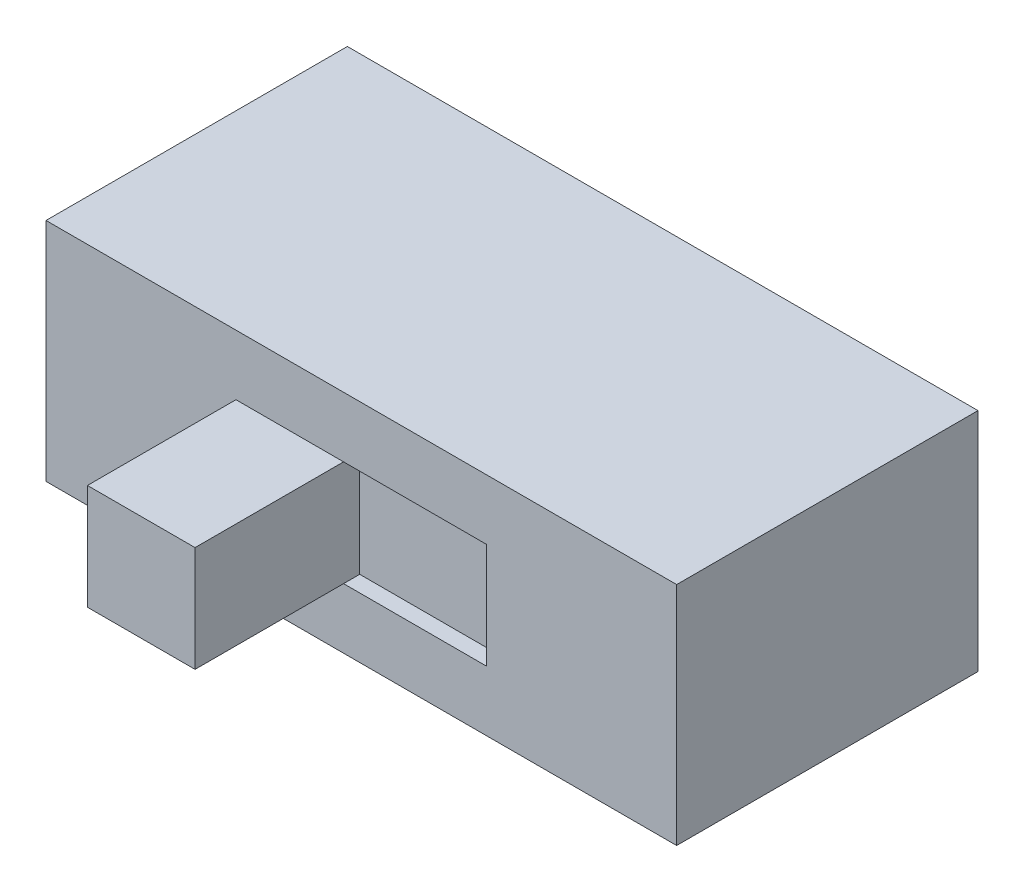
from build123d import *

# Parameters (mm, degrees)
SKETCH1_W           = 11.72
SKETCH1_H           = 5.6
BOSS_EXTRUDE1_DEPTH = 4.2
SKETCH2_W           = 2
SKETCH2_H           = 1.96
BOSS_EXTRUDE2_DEPTH = 2.76
SKETCH2_3_W         = 2.66
SKETCH2_3_H         = 1.96
CUT_EXTRUDE1_DEPTH  = 0.3


with BuildPart() as part:
    # Sketch1 → Boss-Extrude1 (new body)
    with BuildSketch(Plane(origin=(0, 0, 0), x_dir=(1, 0, 0), z_dir=(0, 1, 0))):
        Rectangle(SKETCH1_W, SKETCH1_H)
    extrude(amount=BOSS_EXTRUDE1_DEPTH)

    # Sketch2 → Boss-Extrude2 (add)
    with BuildSketch(Plane.XY.offset(2.8)):
        with Locations((-1.33, 2.1)):
            Rectangle(SKETCH2_W, SKETCH2_H)
    extrude(amount=BOSS_EXTRUDE2_DEPTH)

    # Sketch2<3> → Cut-Extrude1 (cut)
    with BuildSketch(Plane.XY.offset(2.8)):
        with Locations((1, 2.1)):
            Rectangle(SKETCH2_3_W, SKETCH2_3_H)
    extrude(amount=-CUT_EXTRUDE1_DEPTH, mode=Mode.SUBTRACT)


solid = part.part
